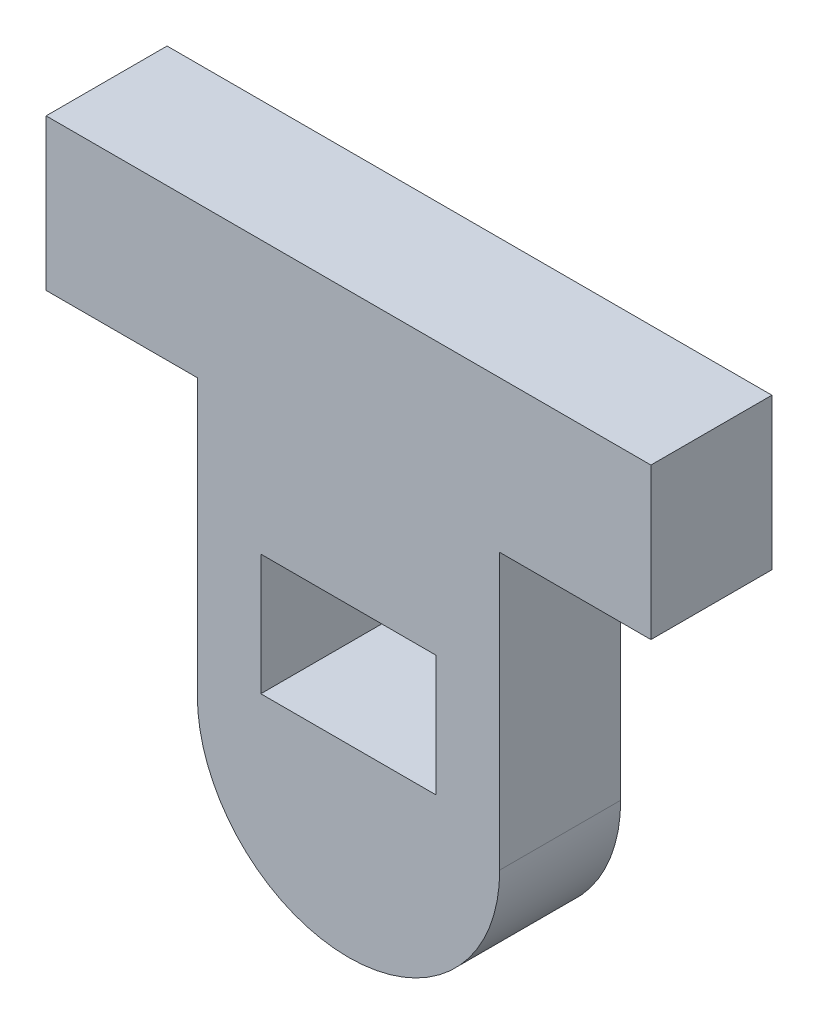
from build123d import *

# Parameters (mm, degrees)
BOSS_EXTRUDE1_DEPTH = 5.08
CUT_EXTRUDE1_DEPTH  = 32.75406374


with BuildPart() as part:
    # Sketch1 → Boss-Extrude1 (new body)
    with BuildSketch(Plane.XY):
        with BuildLine():
            Line((12.7, 18.542), (19.05, 18.542))
            Line((19.05, 18.542), (19.05, 24.892))
            Line((19.05, 24.892), (-6.35, 24.892))
            Line((-6.35, 24.892), (-6.35, 18.542))
            Line((-6.35, 18.542), (0, 18.542))
            Line((0, 18.542), (0, 6.985))
            ThreePointArc((0, 6.985), (6.35, 0.635), (12.7, 6.985))
            Line((12.7, 6.985), (12.7, 18.542))
        make_face()
    extrude(amount=BOSS_EXTRUDE1_DEPTH)

    # Sketch2 → Cut-Extrude1 (cut, through all)
    with BuildSketch(Plane.XY.offset(5.08)):
        Polygon((6.35, 13.462), (10.033, 13.462), (10.033, 8.382), (2.667, 8.382), (2.667, 13.462), align=None)
    extrude(amount=-CUT_EXTRUDE1_DEPTH, mode=Mode.SUBTRACT)


solid = part.part
